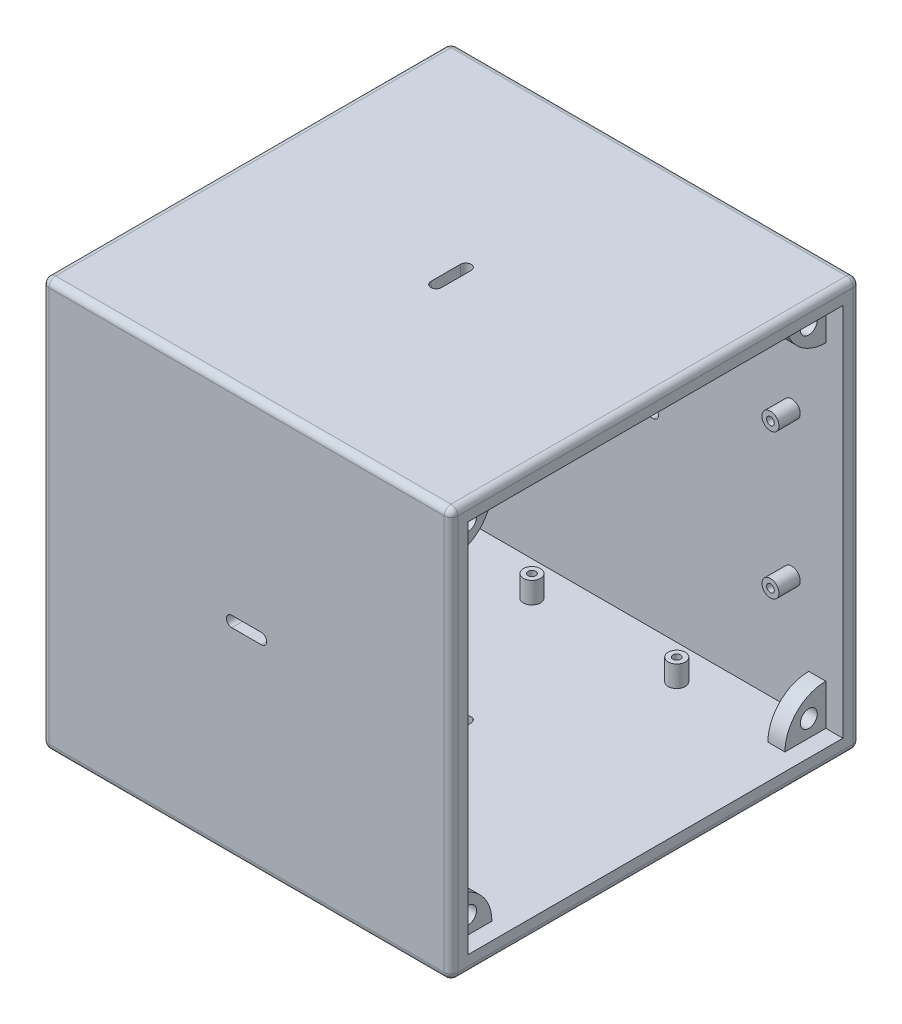
from build123d import *

# Parameters (mm, degrees)
SKETCH1_W           = 152.4
SKETCH1_H           = 152.4
BOSS_EXTRUDE1_DEPTH = 152.4
SHELL2_T            = -6.35
CUT_EXTRUDE3_DEPTH  = 6.35
CUT_EXTRUDE4_DEPTH  = 6.35
CUT_EXTRUDE5_START  = -6.35
CUT_EXTRUDE5_DEPTH  = 6.35
CUT_EXTRUDE6_DEPTH  = 6.35
SKETCH6_W           = 6.35
SKETCH6_H           = 152.4
BOSS_EXTRUDE2_DEPTH = 139.7
CUT_EXTRUDE7_DEPTH  = 6.35
SKETCH8_R           = 3.175
CUT_EXTRUDE8_DEPTH  = 6.35
SKETCH10_R          = 3.175
SKETCH10_R_2        = 1.42875
BOSS_EXTRUDE3_DEPTH = 7.9375
SKETCH11_R          = 3.175
SKETCH11_R_2        = 1.42875
BOSS_EXTRUDE4_DEPTH = 7.9375
SKETCH15_R          = 3.175
SKETCH15_R_2        = 1.42875
BOSS_EXTRUDE5_DEPTH = 7.9375
FILLET1_R           = 2.54
FILLET2_R           = 2.54


with BuildPart() as part:
    # Sketch1 → Boss-Extrude1 (new body)
    with BuildSketch(Plane(origin=(0, 0, 0), x_dir=(1, 0, 0), z_dir=(0, 1, 0))):
        Rectangle(SKETCH1_W, SKETCH1_H)
    extrude(amount=BOSS_EXTRUDE1_DEPTH)

    # Shell2
    shell2_openings = [part.faces().sort_by_distance(p)[0] for p in [
        (76.2, 76.2, 0),
    ]]
    offset(amount=SHELL2_T, openings=shell2_openings, kind=Kind.INTERSECTION)

    # Sketch2 → Cut-Extrude3 (cut)
    with BuildSketch(Plane(origin=(-69.85, 0, 0), x_dir=(0, 0, -1), z_dir=(1, 0, 0))):
        with BuildLine():
            Line((0, 76.2), (-6.498479396, 74.467072161))
            ThreePointArc((-6.498479396, 74.467072161), (-6.016790249, 74.267921368), (-5.5, 74.2))
            Line((-5.5, 74.2), (5.5, 74.2))
            ThreePointArc((5.5, 74.2), (6.016790249, 74.267921368), (6.498479396, 74.467072161))
            Line((6.498479396, 74.467072161), (0, 76.2))
        make_face()
        with BuildLine():
            Line((6.498479396, 77.932927839), (0, 76.2))
            Line((0, 76.2), (6.498479396, 74.467072161))
            ThreePointArc((6.498479396, 74.467072161), (7.5, 76.2), (6.498479396, 77.932927839))
        make_face()
        with BuildLine():
            Line((-6.498479396, 77.932927839), (0, 76.2))
            Line((0, 76.2), (6.498479396, 77.932927839))
            ThreePointArc((6.498479396, 77.932927839), (6.016790249, 78.132078632), (5.5, 78.2))
            Line((5.5, 78.2), (-5.5, 78.2))
            ThreePointArc((-5.5, 78.2), (-6.016790249, 78.132078632), (-6.498479396, 77.932927839))
        make_face()
        with BuildLine():
            ThreePointArc((-6.498479396, 77.932927839), (-7.5, 76.2), (-6.498479396, 74.467072161))
            Line((-6.498479396, 74.467072161), (0, 76.2))
            Line((0, 76.2), (-6.498479396, 77.932927839))
        make_face()
    extrude(amount=-CUT_EXTRUDE3_DEPTH, mode=Mode.SUBTRACT)

    # Sketch3 → Cut-Extrude4 (cut)
    with BuildSketch(Plane.XY.offset(-69.85)):
        with BuildLine():
            Line((-5.5, 78.2), (5.5, 78.2))
            ThreePointArc((5.5, 78.2), (7.5, 76.2), (5.5, 74.2))
            Line((5.5, 74.2), (-5.5, 74.2))
            ThreePointArc((-5.5, 74.2), (-7.5, 76.2), (-5.5, 78.2))
        make_face()
    extrude(amount=-CUT_EXTRUDE4_DEPTH, mode=Mode.SUBTRACT)

    # Sketch4 → Cut-Extrude5 (cut)
    with BuildSketch(Plane(origin=(0, 0, 69.85), x_dir=(-1, 0, 0), z_dir=(0, 0, -1)).offset(CUT_EXTRUDE5_START)):
        with BuildLine():
            Line((-5.5, 78.2), (5.5, 78.2))
            ThreePointArc((5.5, 78.2), (7.5, 76.2), (5.5, 74.2))
            Line((5.5, 74.2), (-5.5, 74.2))
            ThreePointArc((-5.5, 74.2), (-7.5, 76.2), (-5.5, 78.2))
        make_face()
    extrude(amount=CUT_EXTRUDE5_DEPTH, mode=Mode.SUBTRACT)

    # Sketch5 → Cut-Extrude6 (cut)
    with BuildSketch(Plane.XZ.offset(-146.05)):
        with BuildLine():
            Line((-2, -5.5), (-2, 5.5))
            ThreePointArc((-2, 5.5), (0, 7.5), (2, 5.5))
            Line((2, 5.5), (2, -5.5))
            ThreePointArc((2, -5.5), (0, -7.5), (-2, -5.5))
        make_face()
    cut_extrude6 = extrude(amount=-CUT_EXTRUDE6_DEPTH, mode=Mode.SUBTRACT)

    # Mirror1: Cut-Extrude6 across plane
    add(cut_extrude6.mirror(Plane.ZX.offset(76.2)), mode=Mode.SUBTRACT)

    # Sketch6 → Boss-Extrude2 (add)
    with BuildSketch(Plane.XZ.offset(-146.05)):
        with Locations((66.675, 0)):
            Rectangle(SKETCH6_W, SKETCH6_H)
    extrude(amount=BOSS_EXTRUDE2_DEPTH)

    # Sketch7 → Cut-Extrude7 (cut)
    with BuildSketch(Plane(origin=(69.85, 0, 0), x_dir=(0, 0, -1), z_dir=(1, 0, 0))):
        with BuildLine():
            Line((69.85, 21.59), (69.85, 130.81))
            ThreePointArc((69.85, 130.81), (59.073692655, 135.273692655), (54.61, 146.05))
            Line((54.61, 146.05), (-54.61, 146.05))
            ThreePointArc((-54.61, 146.05), (-59.073692655, 135.273692655), (-69.85, 130.81))
            Line((-69.85, 130.81), (-69.85, 21.59))
            ThreePointArc((-69.85, 21.59), (-59.073692655, 17.126307345), (-54.61, 6.35))
            Line((-54.61, 6.35), (54.61, 6.35))
            ThreePointArc((54.61, 6.35), (59.073692655, 17.126307345), (69.85, 21.59))
        make_face()
    extrude(amount=-CUT_EXTRUDE7_DEPTH, mode=Mode.SUBTRACT)

    # Sketch8 → Cut-Extrude8 (cut)
    with BuildSketch(Plane(origin=(69.85, 0, 0), x_dir=(0, 0, -1), z_dir=(1, 0, 0))):
        with Locations((63.5, 12.7)):
            Circle(SKETCH8_R)
        with Locations(Location((63.5, 139.7, 0), (0, 0, 180))):
            Circle(SKETCH8_R)
        with Locations((-63.5, 139.7)):
            Circle(SKETCH8_R)
        with Locations(Location((-63.5, 12.7, 0), (0, 0, 180))):
            Circle(SKETCH8_R)
    extrude(amount=-CUT_EXTRUDE8_DEPTH, mode=Mode.SUBTRACT)

    # Sketch10 → Boss-Extrude3 (add)
    # profile 1 of 4: a face of its own
    with BuildSketch(Plane(origin=(0, 0, 69.85), x_dir=(-1, 0, 0), z_dir=(0, 0, -1))):
        with Locations((-57.15, 103.1875)):
            Circle(SKETCH10_R)
        with Locations((-57.15, 103.1875)):
            Circle(SKETCH10_R_2, mode=Mode.SUBTRACT)
    # profile 2 of 4: a face of its own
    with BuildSketch(Plane(origin=(0, 0, 69.85), x_dir=(-1, 0, 0), z_dir=(0, 0, -1))):
        with Locations((-57.15, 49.2125)):
            Circle(SKETCH10_R)
        with Locations((-57.15, 49.2125)):
            Circle(SKETCH10_R_2, mode=Mode.SUBTRACT)
    # profile 3 of 4: a face of its own
    with BuildSketch(Plane(origin=(0, 0, 69.85), x_dir=(-1, 0, 0), z_dir=(0, 0, -1))):
        with Locations((57.15, 49.2125)):
            Circle(SKETCH10_R)
        with Locations((57.15, 49.2125)):
            Circle(SKETCH10_R_2, mode=Mode.SUBTRACT)
    # profile 4 of 4: a face of its own
    with BuildSketch(Plane(origin=(0, 0, 69.85), x_dir=(-1, 0, 0), z_dir=(0, 0, -1))):
        with Locations((57.15, 103.1875)):
            Circle(SKETCH10_R)
        with Locations((57.15, 103.1875)):
            Circle(SKETCH10_R_2, mode=Mode.SUBTRACT)
    boss_extrude3 = extrude(amount=BOSS_EXTRUDE3_DEPTH)

    # Mirror2: Boss-Extrude3 across plane
    add(boss_extrude3.mirror(Plane.XY))

    # Sketch11 → Boss-Extrude4 (add)
    # profile 1 of 4: a face of its own
    with BuildSketch(Plane(origin=(0, 6.35, 0), x_dir=(1, 0, 0), z_dir=(0, 1, 0))):
        with Locations(Location((-26.9875, -57.15, 0), (0, 0, 90))):
            Circle(SKETCH11_R)
        with Locations(Location((-26.9875, -57.15, 0), (0, 0, 270))):
            Circle(SKETCH11_R_2, mode=Mode.SUBTRACT)
    # profile 2 of 4: a face of its own
    with BuildSketch(Plane(origin=(0, 6.35, 0), x_dir=(1, 0, 0), z_dir=(0, 1, 0))):
        with Locations(Location((26.9875, -57.15, 0), (0, 0, 90))):
            Circle(SKETCH11_R)
        with Locations(Location((26.9875, -57.15, 0), (0, 0, 270))):
            Circle(SKETCH11_R_2, mode=Mode.SUBTRACT)
    # profile 3 of 4: a face of its own
    with BuildSketch(Plane(origin=(0, 6.35, 0), x_dir=(1, 0, 0), z_dir=(0, 1, 0))):
        with Locations(Location((26.9875, 57.15, 0), (0, 0, 90))):
            Circle(SKETCH11_R)
        with Locations(Location((26.9875, 57.15, 0), (0, 0, 270))):
            Circle(SKETCH11_R_2, mode=Mode.SUBTRACT)
    # profile 4 of 4: a face of its own
    with BuildSketch(Plane(origin=(0, 6.35, 0), x_dir=(1, 0, 0), z_dir=(0, 1, 0))):
        with Locations(Location((-26.9875, 57.15, 0), (0, 0, 90))):
            Circle(SKETCH11_R)
        with Locations(Location((-26.9875, 57.15, 0), (0, 0, 270))):
            Circle(SKETCH11_R_2, mode=Mode.SUBTRACT)
    boss_extrude4 = extrude(amount=BOSS_EXTRUDE4_DEPTH)

    # Mirror3: Boss-Extrude4 across plane
    add(boss_extrude4.mirror(Plane.ZX.offset(76.2)))

    # Sketch15 → Boss-Extrude5 (add)
    # profile 1 of 4: a face of its own
    with BuildSketch(Plane(origin=(-69.85, 0, 0), x_dir=(0, 0, -1), z_dir=(1, 0, 0))):
        with Locations((-57.15, 103.1875)):
            Circle(SKETCH15_R)
        with Locations((-57.15, 103.1875)):
            Circle(SKETCH15_R_2, mode=Mode.SUBTRACT)
    # profile 2 of 4: a face of its own
    with BuildSketch(Plane(origin=(-69.85, 0, 0), x_dir=(0, 0, -1), z_dir=(1, 0, 0))):
        with Locations((-57.15, 49.2125)):
            Circle(SKETCH15_R)
        with Locations((-57.15, 49.2125)):
            Circle(SKETCH15_R_2, mode=Mode.SUBTRACT)
    # profile 3 of 4: a face of its own
    with BuildSketch(Plane(origin=(-69.85, 0, 0), x_dir=(0, 0, -1), z_dir=(1, 0, 0))):
        with Locations((57.15, 49.2125)):
            Circle(SKETCH15_R)
        with Locations((57.15, 49.2125)):
            Circle(SKETCH15_R_2, mode=Mode.SUBTRACT)
    # profile 4 of 4: a face of its own
    with BuildSketch(Plane(origin=(-69.85, 0, 0), x_dir=(0, 0, -1), z_dir=(1, 0, 0))):
        with Locations((57.15, 103.1875)):
            Circle(SKETCH15_R)
        with Locations((57.15, 103.1875)):
            Circle(SKETCH15_R_2, mode=Mode.SUBTRACT)
    extrude(amount=BOSS_EXTRUDE5_DEPTH)

    # Fillet1
    fillet1_edges = [part.edges().sort_by_distance(p)[0] for p in [
        (76.2, 76.2, 76.2),
        (-76.2, 76.2, 76.2),
        (-76.2, 76.2, -76.2),
        (76.2, 76.2, -76.2),
    ]]
    fillet(fillet1_edges, radius=FILLET1_R)

    # Fillet2
    fillet2_edges = [part.edges().sort_by_distance(p)[0] for p in [
        (76.2, 0, 0),
        (76.2, 152.4, 0),
        (0, 0, 76.2),
        (-76.2, 0, 0),
        (0, 0, -76.2),
        (75.456051224, 0, -75.456051224),
        (-75.456051224, 0, -75.456051224),
        (-75.456051224, 0, 75.456051224),
        (75.456051224, 0, 75.456051224),
        (0, 152.4, 76.2),
        (0, 152.4, -76.2),
        (-76.2, 152.4, 0),
        (75.456051224, 152.4, -75.456051224),
        (-75.456051224, 152.4, -75.456051224),
        (-75.456051224, 152.4, 75.456051224),
        (75.456051224, 152.4, 75.456051224),
    ]]
    fillet(fillet2_edges, radius=FILLET2_R)


solid = part.part
